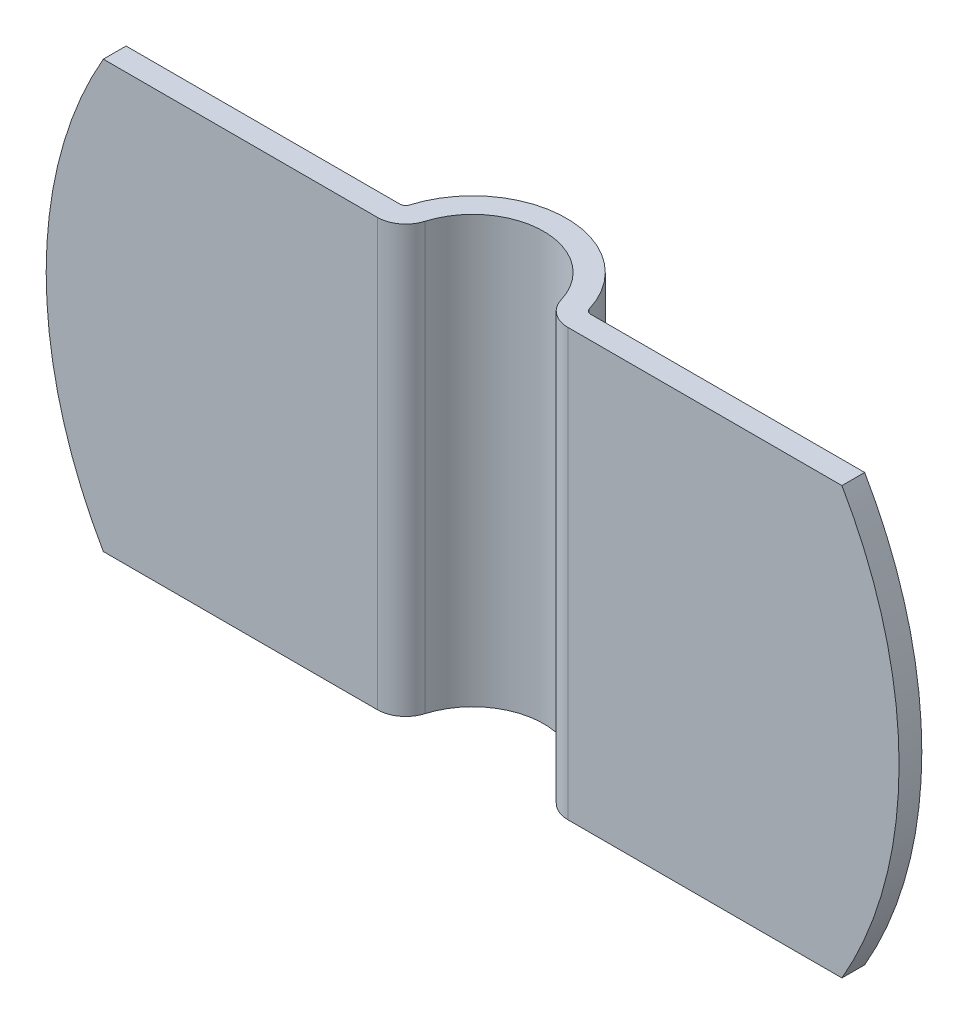
from build123d import *

# Parameters (mm, degrees)
EXTRUDE_THIN1_DEPTH = 3
SKETCH2_OUTSIDE_W   = 9.348
SKETCH2_OUTSIDE_H   = 6.348
SKETCH2_OUTSIDE_R   = 3
EXTRUDE2_DEPTH      = 5.293669759


with BuildPart() as part:
    # Sketch1 → Extrude-Thin1 (new body)
    with BuildSketch(Plane(origin=(0, 0, 0), x_dir=(1, 0, 0), z_dir=(0, 1, 0))):
        with BuildLine():
            Line((-3, 0), (-0.670820393, 0))
            ThreePointArc((-0.670820393, 0), (-0.551297532, 0.039643255), (-0.479157424, 0.142857143))
            ThreePointArc((-0.479157424, 0.142857143), (0, 0.5), (0.479157424, 0.142857143))
            ThreePointArc((0.479157424, 0.142857143), (0.551297532, 0.039643255), (0.670820393, 0))
            Line((0.670820393, 0), (3, 0))
            Line((3, 0), (3, 0.16))
            Line((3, 0.16), (0.670820393, 0.16))
            ThreePointArc((0.670820393, 0.16), (0.646915821, 0.167928651), (0.632487799, 0.188571429))
            ThreePointArc((0.632487799, 0.188571429), (0, 0.66), (-0.632487799, 0.188571429))
            ThreePointArc((-0.632487799, 0.188571429), (-0.646915821, 0.167928651), (-0.670820393, 0.16))
            Line((-0.670820393, 0.16), (-3, 0.16))
            Line((-3, 0.16), (-3, 0))
        make_face()
    extrude(amount=EXTRUDE_THIN1_DEPTH)

    # Sketch2 outside → Extrude2 (cut, through all)
    with BuildSketch(Plane.XY):
        with Locations((0, 1.5)):
            Rectangle(SKETCH2_OUTSIDE_W, SKETCH2_OUTSIDE_H)
        with Locations((0, 1.5)):
            Circle(SKETCH2_OUTSIDE_R, mode=Mode.SUBTRACT)
    extrude(amount=-EXTRUDE2_DEPTH, mode=Mode.SUBTRACT)


solid = part.part
